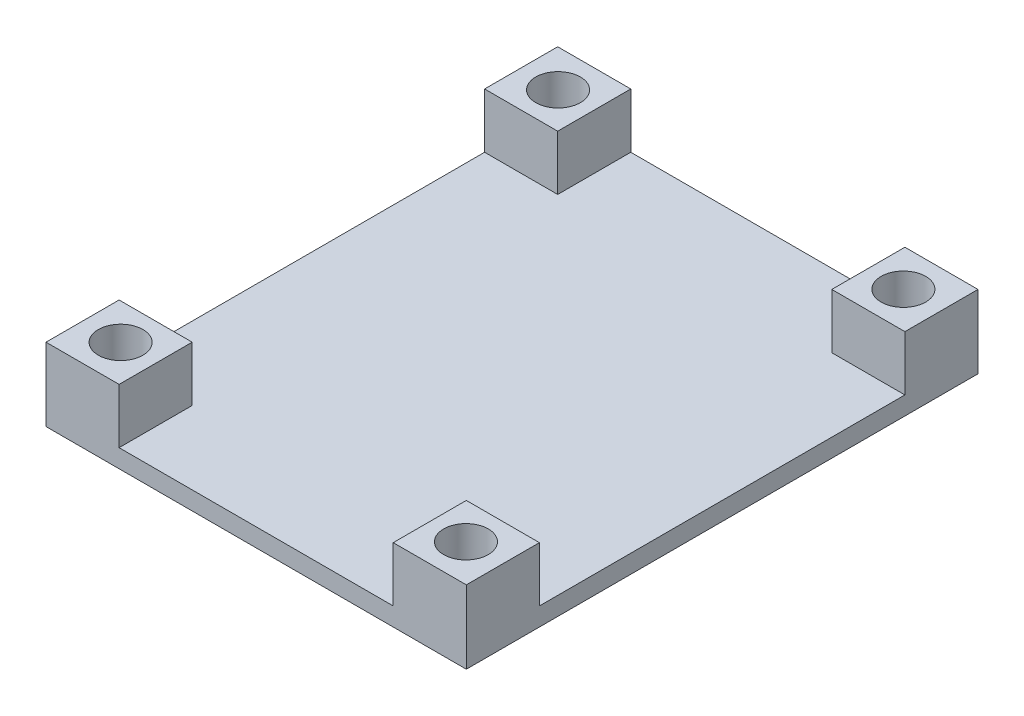
from build123d import *

# Parameters (mm, degrees)
SKETCH1_W           = 29.21
SKETCH1_H           = 35.56
SKETCH1_R           = 1.5499969
BOSS_EXTRUDE1_DEPTH = 5.08
SKETCH2_W           = 5.08
SKETCH2_H           = 25.4
SKETCH2_W_2         = 19.05
SKETCH2_H_2         = 5.08
CUT_EXTRUDE1_DEPTH  = 3.81


with BuildPart() as part:
    # Sketch1 → Boss-Extrude1 (new body)
    with BuildSketch(Plane(origin=(0, 0, 0), x_dir=(1, 0, 0), z_dir=(0, 1, 0))):
        with Locations((2.211294118, -3.505162647)):
            Rectangle(SKETCH1_W, SKETCH1_H)
        with Locations(Location((-9.788707282, 11.694832353, 0), (0, 0, 270))):
            Circle(SKETCH1_R, mode=Mode.SUBTRACT)
        with Locations(Location((14.211295518, 11.694832353, 0), (0, 0, 270))):
            Circle(SKETCH1_R, mode=Mode.SUBTRACT)
        with Locations(Location((14.211295518, -18.705157647, 0), (0, 0, 270))):
            Circle(SKETCH1_R, mode=Mode.SUBTRACT)
        with Locations(Location((-9.788707282, -18.705157647, 0), (0, 0, 270))):
            Circle(SKETCH1_R, mode=Mode.SUBTRACT)
    extrude(amount=BOSS_EXTRUDE1_DEPTH)

    # Sketch2 → Cut-Extrude1 (cut)
    with BuildSketch(Plane(origin=(0, 5.08, 0), x_dir=(1, 0, 0), z_dir=(0, 1, 0))):
        with Locations((-9.853705882, -3.505162647)):
            Rectangle(SKETCH2_W, SKETCH2_H)
        with Locations((2.211294118, 11.734837353)):
            Rectangle(SKETCH2_W_2, SKETCH2_H_2)
        with Locations((14.276294118, -3.505162647)):
            Rectangle(SKETCH2_W, SKETCH2_H)
        with Locations((2.211294118, -3.505162647)):
            Rectangle(SKETCH2_W_2, SKETCH2_H)
        with Locations((2.211294118, -18.745162647)):
            Rectangle(SKETCH2_W_2, SKETCH2_H_2)
    extrude(amount=-CUT_EXTRUDE1_DEPTH, mode=Mode.SUBTRACT)


solid = part.part
